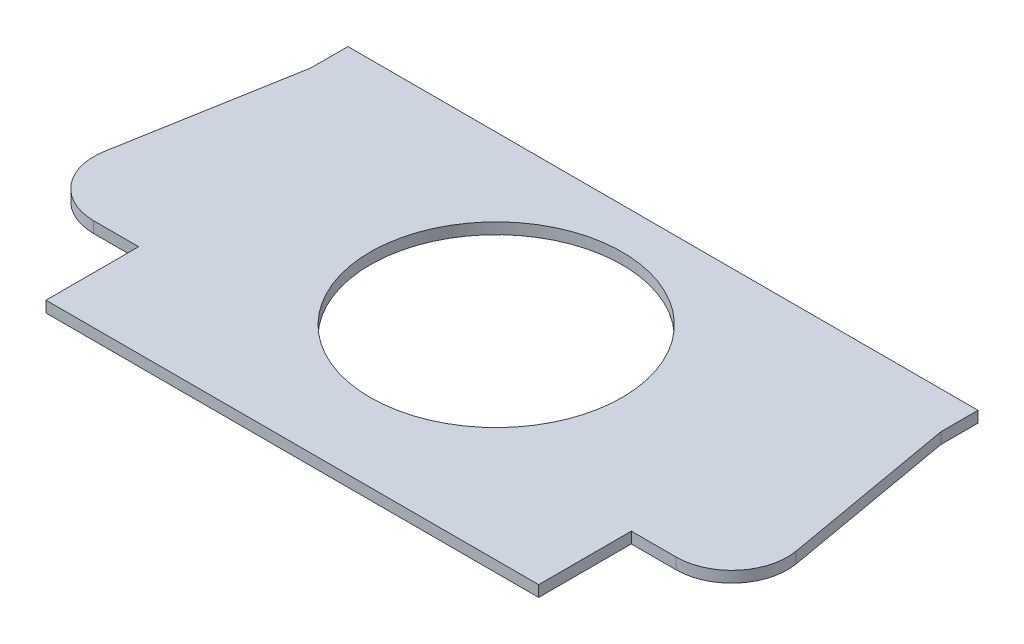
from build123d import *

# Parameters (mm, degrees)
BOSS_EXTRUDE1_DEPTH = 3
SKETCH2_R           = 34
CUT_EXTRUDE2_DEPTH  = 12
FILLET1_R           = 15


with BuildPart() as part:
    # Sketch1 → Boss-Extrude1 (new body)
    with BuildSketch(Plane(origin=(0, 0, 0), x_dir=(1, 0, 0), z_dir=(0, 1, 0))):
        Polygon((85, 90), (85, 100), (-85, 100), (-85, 90), (-96.461253746, 25), (-66.461253746, 25), (-66.461253746, 0), (66.461253746, 0), (66.461253746, 25), (96.461253746, 25), align=None)
    extrude(amount=BOSS_EXTRUDE1_DEPTH)

    # Sketch2 → Cut-Extrude2 (cut)
    with BuildSketch(Plane(origin=(0, 3, 0), x_dir=(1, 0, 0), z_dir=(0, 1, 0))):
        with Locations(Location((0, 55, 0), (0, 0, 270))):
            Circle(SKETCH2_R)
    extrude(amount=-CUT_EXTRUDE2_DEPTH, mode=Mode.SUBTRACT)

    # Fillet1
    fillet1_edges = [part.edges().sort_by_distance(p)[0] for p in [
        (-96.461253746, 1.5, -25),
        (96.461253746, 1.5, -25),
    ]]
    fillet(fillet1_edges, radius=FILLET1_R)


solid = part.part
